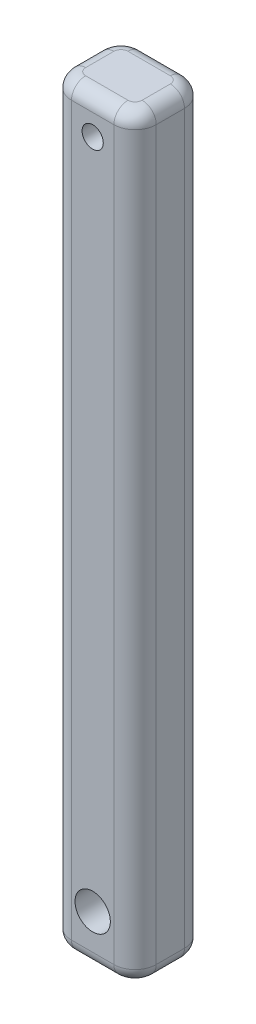
from build123d import *

# Parameters (mm, degrees)
BOSS_EXTRUDE1_DEPTH = 271.78
SKETCH2_R           = 6.35
CUT_EXTRUDE1_DEPTH  = 274.389440176
SKETCH3_R           = 3.81
CUT_EXTRUDE2_DEPTH  = 274.389440176
FILLET1_R           = 5.08
FILLET2_R           = 5.08


with BuildPart() as part:
    # Sketch1 → Boss-Extrude1 (new body)
    with BuildSketch(Plane(origin=(0, 0, 0), x_dir=(1, 0, 0), z_dir=(0, 1, 0))):
        with BuildLine():
            Line((-7.62, 12.7), (7.62, 12.7))
            ThreePointArc((7.62, 12.7), (13.008153673, 10.468153673), (15.24, 5.08))
            Line((15.24, 5.08), (15.24, -5.08))
            ThreePointArc((15.24, -5.08), (13.008153673, -10.468153673), (7.62, -12.7))
            Line((7.62, -12.7), (-7.62, -12.7))
            ThreePointArc((-7.62, -12.7), (-13.008153673, -10.468153673), (-15.24, -5.08))
            Line((-15.24, -5.08), (-15.24, 5.08))
            ThreePointArc((-15.24, 5.08), (-13.008153673, 10.468153673), (-7.62, 12.7))
        make_face()
    extrude(amount=BOSS_EXTRUDE1_DEPTH)

    # Sketch2 → Cut-Extrude1 (cut, through all)
    with BuildSketch(Plane.XY.offset(12.7)):
        with Locations((0, 17.78)):
            Circle(SKETCH2_R)
    extrude(amount=-CUT_EXTRUDE1_DEPTH, mode=Mode.SUBTRACT)

    # Sketch3 → Cut-Extrude2 (cut, through all)
    with BuildSketch(Plane.XY.offset(12.7)):
        with Locations((0, 259.08)):
            Circle(SKETCH3_R)
    extrude(amount=-CUT_EXTRUDE2_DEPTH, mode=Mode.SUBTRACT)

    # Fillet1
    fillet1_edges = [part.edges().sort_by_distance(p)[0] for p in [
        (13.008153673, 271.78, 10.468153673),
        (15.24, 271.78, 0),
        (13.008153673, 271.78, -10.468153673),
        (0, 271.78, -12.7),
        (-13.008153673, 271.78, -10.468153673),
        (-15.24, 271.78, 0),
        (-13.008153673, 271.78, 10.468153673),
        (0, 271.78, 12.7),
    ]]
    fillet(fillet1_edges, radius=FILLET1_R)

    # Fillet2
    fillet2_edges = [part.edges().sort_by_distance(p)[0] for p in [
        (0, 0, 12.7),
        (-13.008153673, 0, 10.468153673),
        (-15.24, 0, 0),
        (-13.008153673, 0, -10.468153673),
        (0, 0, -12.7),
        (13.008153673, 0, -10.468153673),
        (15.24, 0, 0),
        (13.008153673, 0, 10.468153673),
    ]]
    fillet(fillet2_edges, radius=FILLET2_R)


solid = part.part
